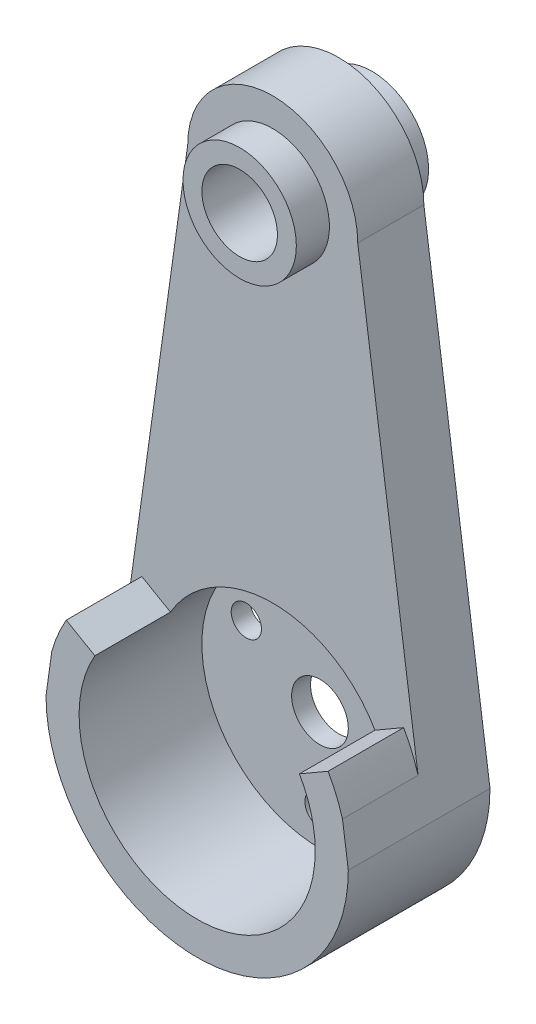
from build123d import *

# Parameters (mm, degrees)
BOSS_EXTRU_1_DEPTH      = 7
ESQUISSE2_R             = 3
ENL_V_MAT_EXTRU_1_DEPTH = 7
ESQUISSE3_R             = 1.6
ENL_V_MAT_EXTRU_2_DEPTH = 7
ESQUISSE5_R             = 12.5
ENL_V_MAT_EXTRU_5_DEPTH = 5
ESQUISSE16_R            = 6
ESQUISSE16_R_2          = 4
BOSS_EXTRU_5_DEPTH      = 3.5
BOSS_EXTRU_6_START      = 3.5
ESQUISSE17_R            = 6
ESQUISSE17_R_2          = 4
BOSS_EXTRU_6_DEPTH      = 3.5
BOSS_EXTRU_8_DEPTH      = 8
ESQUISSE19_R            = 4
ENL_V_MAT_EXTRU_6_DEPTH = 8


with BuildPart() as part:
    # Esquisse1 → Boss.-Extru.1 (new body)
    with BuildSketch(Plane.XY):
        with BuildLine():
            Line((9, 0), (16, -50))
            ThreePointArc((16, -50), (0, -66), (-16, -50))
            Line((-16, -50), (-9, 0))
            ThreePointArc((-9, 0), (0, 9), (9, 0))
        make_face()
    extrude(amount=BOSS_EXTRU_1_DEPTH)

    # Esquisse2 → Enlèv. mat.-Extru.1 (cut)
    with BuildSketch(Plane.XY.offset(7)):
        with Locations((0, -50)):
            Circle(ESQUISSE2_R)
    extrude(amount=-ENL_V_MAT_EXTRU_1_DEPTH, mode=Mode.SUBTRACT)

    # Esquisse3 → Enlèv. mat.-Extru.2 (cut)
    with BuildSketch(Plane.XY.offset(7)):
        with Locations((0, -59)):
            Circle(ESQUISSE3_R)
        with Locations((-7.794228634, -45.5)):
            Circle(ESQUISSE3_R)
        with Locations((7.794228634, -45.5)):
            Circle(ESQUISSE3_R)
    extrude(amount=-ENL_V_MAT_EXTRU_2_DEPTH, mode=Mode.SUBTRACT)

    # Esquisse5 → Enlèv. mat.-Extru.5 (cut)
    with BuildSketch(Plane.XY.offset(7)):
        with Locations((0, -50)):
            Circle(ESQUISSE5_R)
    extrude(amount=-ENL_V_MAT_EXTRU_5_DEPTH, mode=Mode.SUBTRACT)

    # Esquisse16 → Boss.-Extru.5 (add)
    with BuildSketch(Plane(origin=(0, 0, 0), x_dir=(-1, 0, 0), z_dir=(0, 0, -1))):
        Circle(ESQUISSE16_R)
        Circle(ESQUISSE16_R_2, mode=Mode.SUBTRACT)
    extrude(amount=BOSS_EXTRU_5_DEPTH)

    # Esquisse17 → Boss.-Extru.6 (add)
    with BuildSketch(Plane.XY.offset(7).offset(BOSS_EXTRU_6_START)):
        with Locations(Location((0, 0, 0), (0, 0, 180))):
            Circle(ESQUISSE17_R)
        with Locations(Location((0, 0, 0), (0, 0, 180))):
            Circle(ESQUISSE17_R_2, mode=Mode.SUBTRACT)
    extrude(amount=-BOSS_EXTRU_6_DEPTH)

    # Esquisse18 → Boss.-Extru.8 (add)
    with BuildSketch(Plane.XY.offset(7)):
        with BuildLine():
            Line((-10.825317547, -43.75), (-13.856406461, -42))
            ThreePointArc((-13.856406461, -42), (-14.731391476, -43.756114576), (-15.384856807, -45.606120047))
            Line((-15.384856807, -45.606120047), (-16, -50))
            ThreePointArc((-16, -50), (0, -66), (16, -50))
            Line((16, -50), (15.384856807, -45.606120047))
            ThreePointArc((15.384856807, -45.606120047), (14.731391476, -43.756114576), (13.856406461, -42))
            Line((13.856406461, -42), (10.825317547, -43.75))
            ThreePointArc((10.825317547, -43.75), (12.074072829, -46.764761936), (12.5, -50))
            ThreePointArc((12.5, -50), (-3.235238064, -62.074072829), (-10.825317547, -43.75))
        make_face()
    extrude(amount=BOSS_EXTRU_8_DEPTH)

    # Esquisse19 → Enlèv. mat.-Extru.6 (cut)
    with BuildSketch(Plane.XY.offset(7)):
        Circle(ESQUISSE19_R)
    extrude(amount=-ENL_V_MAT_EXTRU_6_DEPTH, mode=Mode.SUBTRACT)


solid = part.part
